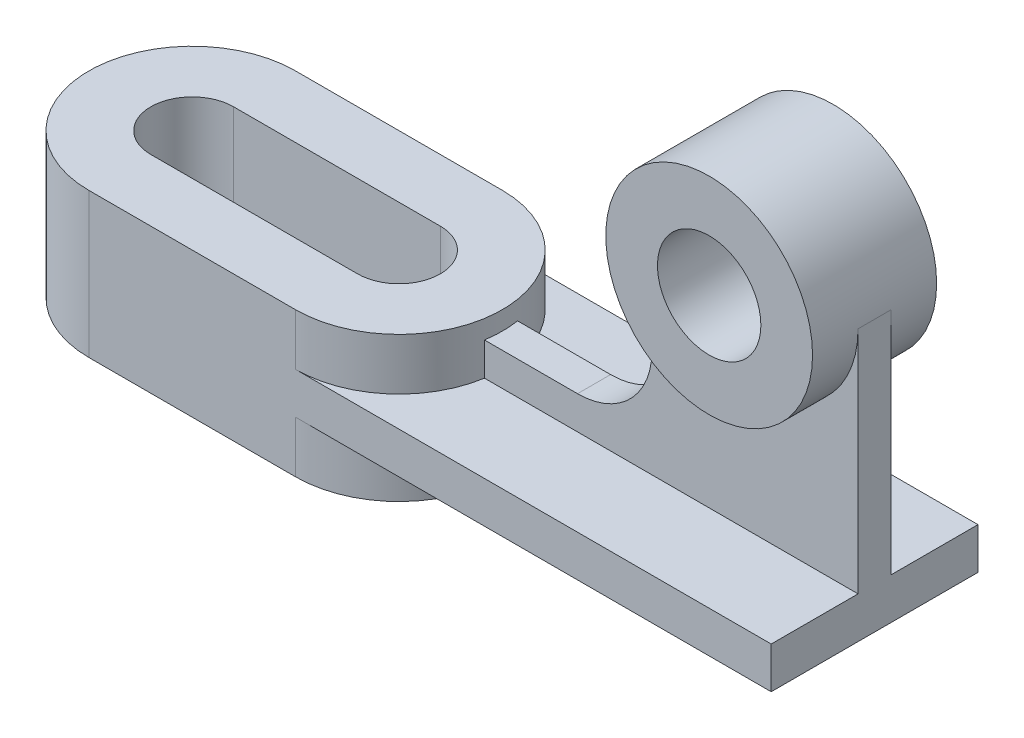
from build123d import *

# Parameters (mm, degrees)
BOSS_EXTRUDE1_DEPTH = 35
BOSS_EXTRUDE2_DEPTH = 50
BOSS_EXTRUDE4_DEPTH = 4
SKETCH4_R           = 25
SKETCH4_R_2         = 12.5
BOSS_EXTRUDE5_DEPTH = 15


with BuildPart() as part:
    # Sketch1 → Boss-Extrude1 (new body)
    with BuildSketch(Plane(origin=(0, 0, 0), x_dir=(1, 0, 0), z_dir=(0, 1, 0))):
        with BuildLine():
            Line((-15.658362989, 25), (34.341637011, 25))
            ThreePointArc((34.341637011, 25), (59.341637011, 0), (34.341637011, -25))
            Line((34.341637011, -25), (-15.658362989, -25))
            ThreePointArc((-15.658362989, -25), (-40.658362989, 0), (-15.658362989, 25))
        make_face()
        with BuildLine():
            Line((-15.658362989, 10), (34.341637011, 10))
            ThreePointArc((34.341637011, 10), (44.341637011, 0), (34.341637011, -10))
            Line((34.341637011, -10), (-15.658362989, -10))
            ThreePointArc((-15.658362989, -10), (-25.658362989, 0), (-15.658362989, 10))
        make_face(mode=Mode.SUBTRACT)
    extrude(amount=-BOSS_EXTRUDE1_DEPTH)

    # Sketch2 → Boss-Extrude2 (add)
    with BuildSketch(Plane.XY.offset(25)):
        Polygon((59.341637011, -12.5), (34.341637011, -12.5), (34.341637011, -22.5), (59.341637011, -22.5), (149.341637011, -22.5), (149.341637011, -12.5), align=None)
    extrude(amount=-BOSS_EXTRUDE2_DEPTH)

    # Sketch3 → Boss-Extrude4 (add, symmetric)
    with BuildSketch(Plane.XY):
        with BuildLine():
            Line((58.524856224, -12.5), (59.341637011, -12.5))
            Line((59.341637011, -12.5), (149.341637011, -12.5))
            Line((149.341637011, -12.5), (149.341637011, 43))
            ThreePointArc((149.341637011, 43), (124.341637011, 18), (99.341637011, 43))
            Line((99.341637011, 43), (99.341637011, 11.044665925))
            ThreePointArc((99.341637011, 11.044665925), (93.33790357, -0.068272059), (81.509886267, -4.5))
            Line((81.509886267, -4.5), (58.524856224, -4.5))
            Line((58.524856224, -4.5), (58.524856224, -12.5))
        make_face()
    extrude(amount=BOSS_EXTRUDE4_DEPTH, both=True)

    # Sketch4 → Boss-Extrude5 (add, symmetric)
    with BuildSketch(Plane.XY):
        with Locations((124.341637011, 43)):
            Circle(SKETCH4_R)
        with Locations((124.341637011, 43)):
            Circle(SKETCH4_R_2, mode=Mode.SUBTRACT)
    extrude(amount=BOSS_EXTRUDE5_DEPTH, both=True)


solid = part.part
